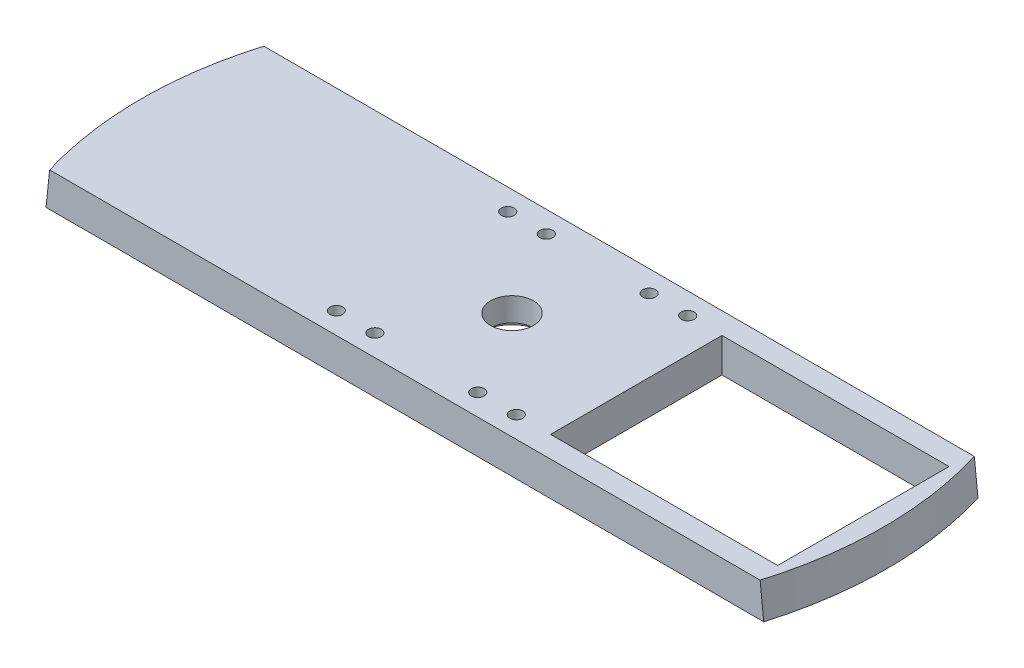
from build123d import *

# Parameters (mm, degrees)
TOP_PLATE_BOSS_EXTRUDE1_DEPTH                  = 25
TOP_PLATE_BOSS_EXTRUDE1_DEPTH_BACK             = 25
SKETCH5_R                                      = 5
SHAFT_CUT_EXTRUDE1_DEPTH                       = 8
SKETCH6_R                                      = 8
SHAFT_BEARING_CUT_EXTRUDE2_DEPTH               = 2.5
SKETCH7_R                                      = 1.5
BEARING_PLATE_MOUNTING_HOLES_CUT_EXTRUDE_DEPTH = 8
SKETCH8_R                                      = 1.5
BASE_SIDE_MOUNTING_HOLES_CUT_EXTRUDE4_DEPTH    = 8
SKETCH9_W                                      = 53
SKETCH9_H                                      = 40
TIMING_BELT_SLIDER_HOLE_CUT_EXTRUDE1_DEPTH     = 8


with BuildPart() as part:
    # Sketch2 → Top Plate Boss-Extrude1 (new, two sides: drawn at the far end of the back side and taken through both)
    with BuildSketch(Plane.XY.offset(-TOP_PLATE_BOSS_EXTRUDE1_DEPTH_BACK)):
        Polygon((-86.592068141, 50), (86.592068141, 50), (87.404678508, 42), (-87.404678508, 42), align=None)
    extrude(amount=TOP_PLATE_BOSS_EXTRUDE1_DEPTH + TOP_PLATE_BOSS_EXTRUDE1_DEPTH_BACK)

    # Sketch4 → Top Plate Chassi Rounding Cut-Revolve1 (revolve, cut)
    with BuildSketch(Plane.XY):
        Polygon((86.592068141, 50), (87.404678508, 42), (97.784973569, 42), (97.784973569, 50), align=None)
    revolve(axis=Axis((0, 0, 0), (0, 1, 0)), mode=Mode.SUBTRACT)

    # Sketch5 → Shaft Cut-Extrude1 (cut)
    with BuildSketch(Plane.XZ.offset(-42)):
        Circle(SKETCH5_R)
    extrude(amount=-SHAFT_CUT_EXTRUDE1_DEPTH, mode=Mode.SUBTRACT)

    # Sketch6 → Shaft Bearing Cut-Extrude2 (cut)
    with BuildSketch(Plane.XZ.offset(-42)):
        Circle(SKETCH6_R)
    extrude(amount=-SHAFT_BEARING_CUT_EXTRUDE2_DEPTH, mode=Mode.SUBTRACT)

    # Sketch7 → Bearing Plate Mounting Holes Cut-Extrude3 (cut)
    with BuildSketch(Plane.XZ.offset(-42)):
        with Locations((12, 20)):
            Circle(SKETCH7_R)
        with Locations((-12, 20)):
            Circle(SKETCH7_R)
        with Locations((-12, -20)):
            Circle(SKETCH7_R)
        with Locations((12, -20)):
            Circle(SKETCH7_R)
    extrude(amount=-BEARING_PLATE_MOUNTING_HOLES_CUT_EXTRUDE_DEPTH, mode=Mode.SUBTRACT)

    # Sketch8 → Base Side Mounting Holes Cut-Extrude4 (cut)
    with BuildSketch(Plane.XZ.offset(-42)):
        with Locations((21, 20)):
            Circle(SKETCH8_R)
        with Locations((-21, 20)):
            Circle(SKETCH8_R)
        with Locations((-21, -20)):
            Circle(SKETCH8_R)
        with Locations((21, -20)):
            Circle(SKETCH8_R)
    extrude(amount=-BASE_SIDE_MOUNTING_HOLES_CUT_EXTRUDE4_DEPTH, mode=Mode.SUBTRACT)

    # Sketch9 → Timing Belt Slider Hole Cut-Extrude1 (cut)
    with BuildSketch(Plane(origin=(0, 50, 0), x_dir=(1, 0, 0), z_dir=(0, 1, 0))):
        with Locations((55.5, 0)):
            Rectangle(SKETCH9_W, SKETCH9_H)
    extrude(amount=-TIMING_BELT_SLIDER_HOLE_CUT_EXTRUDE1_DEPTH, mode=Mode.SUBTRACT)


solid = part.part
